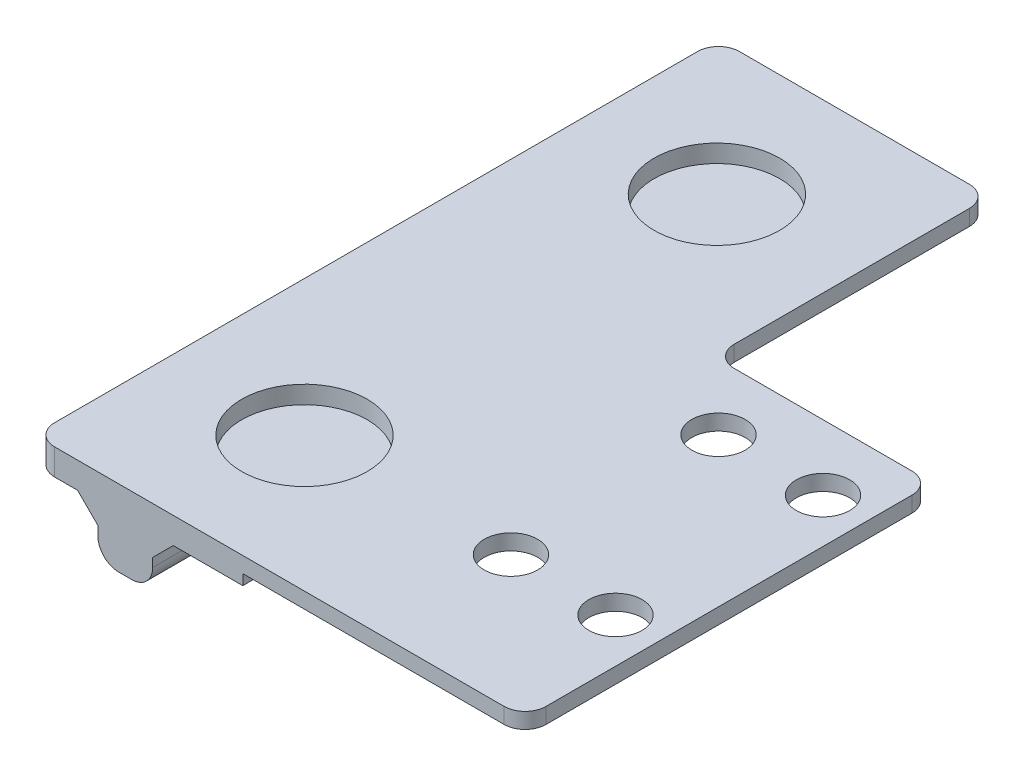
from build123d import *

# Parameters (mm, degrees)
BOSS_EXTRUDE1_DEPTH             = 65.5
CUT_EXTRUDE1_START              = 1.25
SKETCH2_R                       = 6
CUT_EXTRUDE1_DEPTH              = 1.7
BOSS_EXTRUDE2_REACH             = 69.698
SKETCH3_W                       = 21
SKETCH3_H                       = 39
SKETCH3_R                       = 2.55
BOSS_EXTRUDE2_DIRECTION_2_REACH = 69.698
FILLET1_R                       = 2


with BuildPart() as part:
    # Sketch1 → Boss-Extrude1 (new body)
    with BuildSketch(Plane.XY):
        Polygon((-10, -1.25), (-5.8, -1.25), (-3.861348368, -3.188651632), (-3.861348368, -6.058534431), (1.380405129, -6.058534431), (1.380405129, -3.219594871), (3.35, -1.25), (10, -1.25), (10, -0.25), (16, -0.25), (16, 1.25), (10, 1.25), (-10, 1.25), align=None)
    extrude(amount=BOSS_EXTRUDE1_DEPTH)

    # Sketch2 → Cut-Extrude1 (cut)
    with BuildSketch(Plane(origin=(0, 0, 0), x_dir=(1, 0, 0), z_dir=(0, 1, 0)).offset(CUT_EXTRUDE1_START)):
        with Locations(Location((2.75, -12.9, 0), (0, 0, 90))):
            Circle(SKETCH2_R)
        with Locations(Location((3, -52.6, 0), (0, 0, 90))):
            Circle(SKETCH2_R)
    extrude(amount=-CUT_EXTRUDE1_DEPTH, mode=Mode.SUBTRACT)

    # Boss-Extrude2: up to this face of the body (flat: up to its plane)
    boss_extrude2_end = Plane(part.part.faces().sort_by_distance((3.019145607, 1.25, 32.75))[0])
    # Sketch3 → Boss-Extrude2 (add, up to the picked face)
    with BuildSketch(Plane(origin=(0, 0, 0), x_dir=(1, 0, 0), z_dir=(0, 1, 0)), mode=Mode.PRIVATE) as boss_extrude2_sk1:
        with Locations((26.5, -46)):
            Rectangle(SKETCH3_W, SKETCH3_H)
        with Locations(Location((32.75, -52.6, 0), (0, 0, 90))):
            Circle(SKETCH3_R, mode=Mode.SUBTRACT)
        with Locations(Location((32.75, -32.75, 0), (0, 0, 90))):
            Circle(SKETCH3_R, mode=Mode.SUBTRACT)
        with Locations(Location((22.75, -52.6, 0), (0, 0, 90))):
            Circle(SKETCH3_R, mode=Mode.SUBTRACT)
        with Locations(Location((22.75, -32.75, 0), (0, 0, 90))):
            Circle(SKETCH3_R, mode=Mode.SUBTRACT)
    boss_extrude2_tool1 = split(extrude(boss_extrude2_sk1.sketch, amount=BOSS_EXTRUDE2_REACH, mode=Mode.PRIVATE), bisect_by=boss_extrude2_end, keep=Keep.BOTH, mode=Mode.PRIVATE)
    add(boss_extrude2_tool1.solids().sort_by(Axis((26.361464, 0, 46.368507), (0, 1, 0)))[0])

    # Boss-Extrude2 direction 2: up to this face of the body (flat: up to its plane)
    boss_extrude2_direction_2_end = Plane(part.part.faces().sort_by_distance((13, -0.25, 32.75))[0])
    # Sketch3 → Boss-Extrude2 direction 2 (add, up to the picked face)
    with BuildSketch(Plane(origin=(0, 0, 0), x_dir=(1, 0, 0), z_dir=(0, 1, 0)), mode=Mode.PRIVATE) as boss_extrude2_direction_2_sk1:
        with Locations((26.5, -46)):
            Rectangle(SKETCH3_W, SKETCH3_H)
        with Locations(Location((32.75, -52.6, 0), (0, 0, 90))):
            Circle(SKETCH3_R, mode=Mode.SUBTRACT)
        with Locations(Location((32.75, -32.75, 0), (0, 0, 90))):
            Circle(SKETCH3_R, mode=Mode.SUBTRACT)
        with Locations(Location((22.75, -52.6, 0), (0, 0, 90))):
            Circle(SKETCH3_R, mode=Mode.SUBTRACT)
        with Locations(Location((22.75, -32.75, 0), (0, 0, 90))):
            Circle(SKETCH3_R, mode=Mode.SUBTRACT)
    boss_extrude2_direction_2_tool1 = split(extrude(boss_extrude2_direction_2_sk1.sketch, amount=-BOSS_EXTRUDE2_DIRECTION_2_REACH, mode=Mode.PRIVATE), bisect_by=boss_extrude2_direction_2_end, keep=Keep.BOTH, mode=Mode.PRIVATE)
    add(boss_extrude2_direction_2_tool1.solids().sort_by(Axis((26.361464, 0, 46.368507), (0, -1, 0)))[0])

    # Fillet1
    fillet1_edges = [part.edges().sort_by_distance(p)[0] for p in [
        (-10, 0, 65.5),
        (16, 0.5, 0),
        (-10, 0, 0),
        (1.380405129, -6.058534431, 32.75),
        (-3.861348368, -6.058534431, 32.75),
        (37, 0.5, 65.5),
        (37, 0.5, 26.5),
        (16, 0.5, 26.5),
    ]]
    fillet(fillet1_edges, radius=FILLET1_R)


solid = part.part
